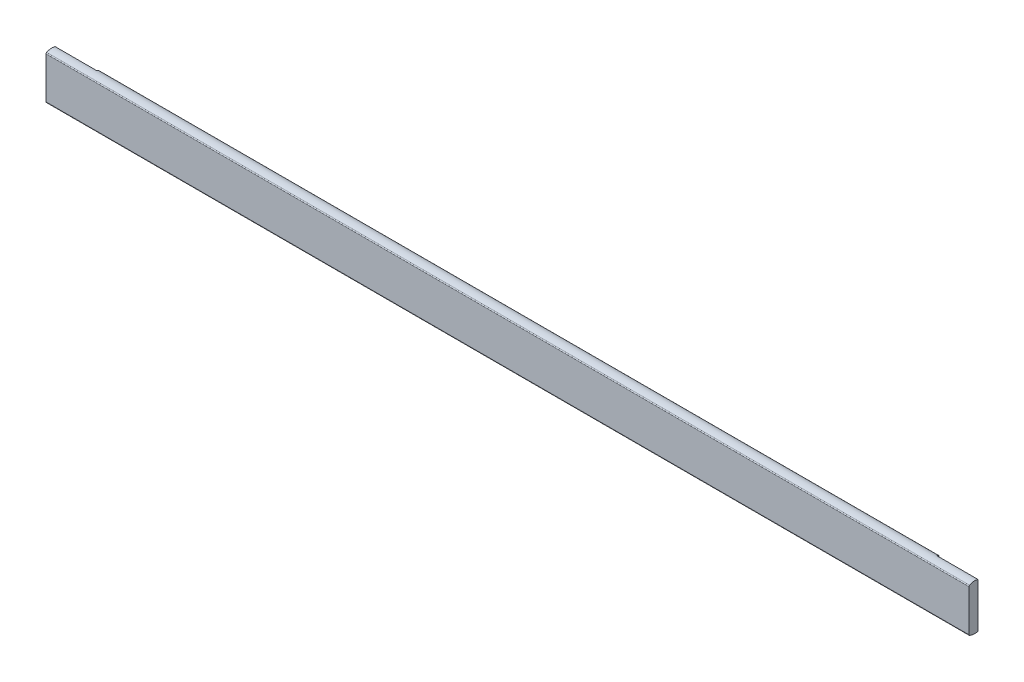
from build123d import *

# Parameters (mm, degrees)
BOSS_EXTRUDE2_DEPTH     = 1021.08
FILLET1_R               = 2.54
CUT_EXTRUDE1_DEPTH      = 1023.421780089
CUT_EXTRUDE1_DEPTH_BACK = 1023.421780089
SKETCH2_W               = 91.44
SKETCH2_H               = 5.08


with BuildPart() as part:
    # Sketch1 → Boss-Extrude2 (new, symmetric)
    with BuildSketch(Plane(origin=(0, 0, 0), x_dir=(0, 0, -1), z_dir=(1, 0, 0))):
        with BuildLine():
            ThreePointArc((-12.7, -47.397045256), (-6.574003886, -49.93451595), (-2.91e-07, -50.8))
            ThreePointArc((-2.91e-07, -50.8), (6.574003605, -49.934516025), (12.7, -47.397045256))
            Line((12.7, -47.397045256), (12.7, 47.397045256))
            ThreePointArc((12.7, 47.397045256), (6.574003746, 49.934515988), (0, 50.8))
            ThreePointArc((0, 50.8), (-6.574003746, 49.934515988), (-12.7, 47.397045256))
            Line((-12.7, 47.397045256), (-12.7, -47.397045256))
        make_face()
    extrude(amount=BOSS_EXTRUDE2_DEPTH, both=True)

    # Fillet1
    fillet1_edges = [part.edges().sort_by_distance(p)[0] for p in [
        (-510.54, 47.397045256, 12.7),
        (510.54, 47.397045256, -12.7),
        (-510.54, -47.397045256, -12.7),
        (0, -47.397045256, 12.7),
    ]]
    fillet(fillet1_edges, radius=FILLET1_R)

    # Sketch2 → Cut-Extrude1 (cut, two sides: drawn at the far end of the back side and taken through both)
    with BuildSketch(Plane(origin=(0, 0, 0), x_dir=(1, 0, 0), z_dir=(0, 1, 0)).offset(-CUT_EXTRUDE1_DEPTH_BACK)):
        with Locations((975.36, 10.16)):
            Rectangle(SKETCH2_W, SKETCH2_H)
        with Locations((-975.36, 10.16)):
            Rectangle(SKETCH2_W, SKETCH2_H)
    extrude(amount=CUT_EXTRUDE1_DEPTH + CUT_EXTRUDE1_DEPTH_BACK, mode=Mode.SUBTRACT)


solid = part.part
